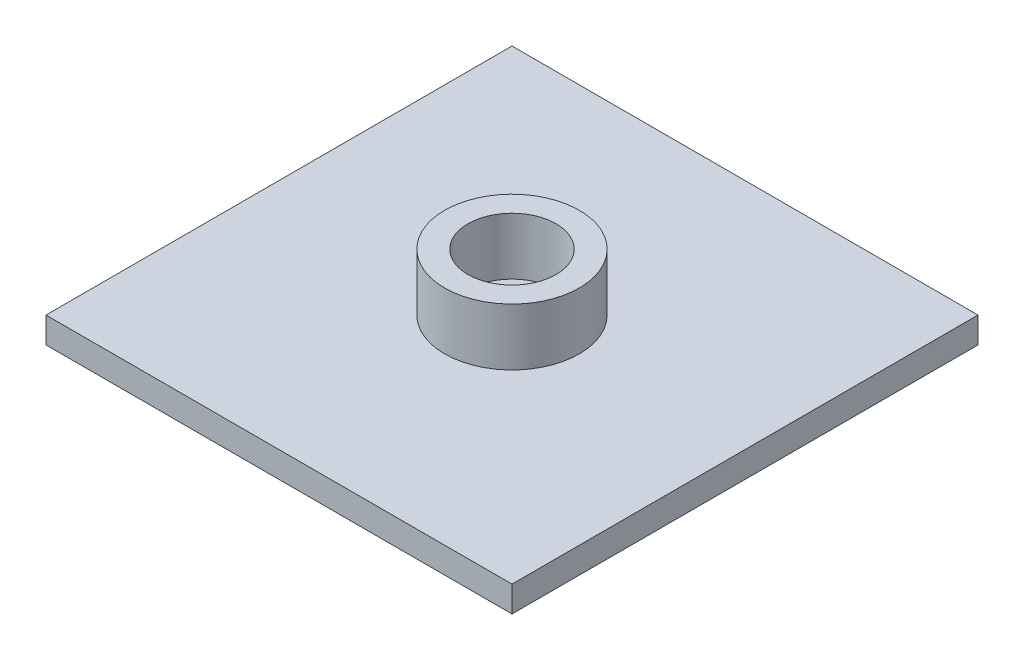
from build123d import *

# Parameters (mm, degrees)
SKETCH1_W           = 114.3
SKETCH1_H           = 114.3
BOSS_EXTRUDE1_DEPTH = 6.35
SKETCH2_R           = 16.51
BOSS_EXTRUDE2_DEPTH = 14
SKETCH3_R           = 10.8
CUT_EXTRUDE1_DEPTH  = 14


with BuildPart() as part:
    # Sketch1 → Boss-Extrude1 (new body)
    with BuildSketch(Plane(origin=(0, 0, 0), x_dir=(1, 0, 0), z_dir=(0, 1, 0))):
        with Locations((57.15, 57.15)):
            Rectangle(SKETCH1_W, SKETCH1_H)
    extrude(amount=BOSS_EXTRUDE1_DEPTH)

    # Sketch2 → Boss-Extrude2 (add)
    with BuildSketch(Plane(origin=(0, 6.35, 0), x_dir=(1, 0, 0), z_dir=(0, 1, 0))):
        with Locations(Location((57.15, 57.15, 0), (0, 0, 270))):
            Circle(SKETCH2_R)
    extrude(amount=BOSS_EXTRUDE2_DEPTH)

    # Sketch3 → Cut-Extrude1 (cut)
    with BuildSketch(Plane(origin=(0, 20.35, 0), x_dir=(1, 0, 0), z_dir=(0, 1, 0))):
        with Locations(Location((57.15, 57.15, 0), (0, 0, 270))):
            Circle(SKETCH3_R)
    extrude(amount=-CUT_EXTRUDE1_DEPTH, mode=Mode.SUBTRACT)


solid = part.part
